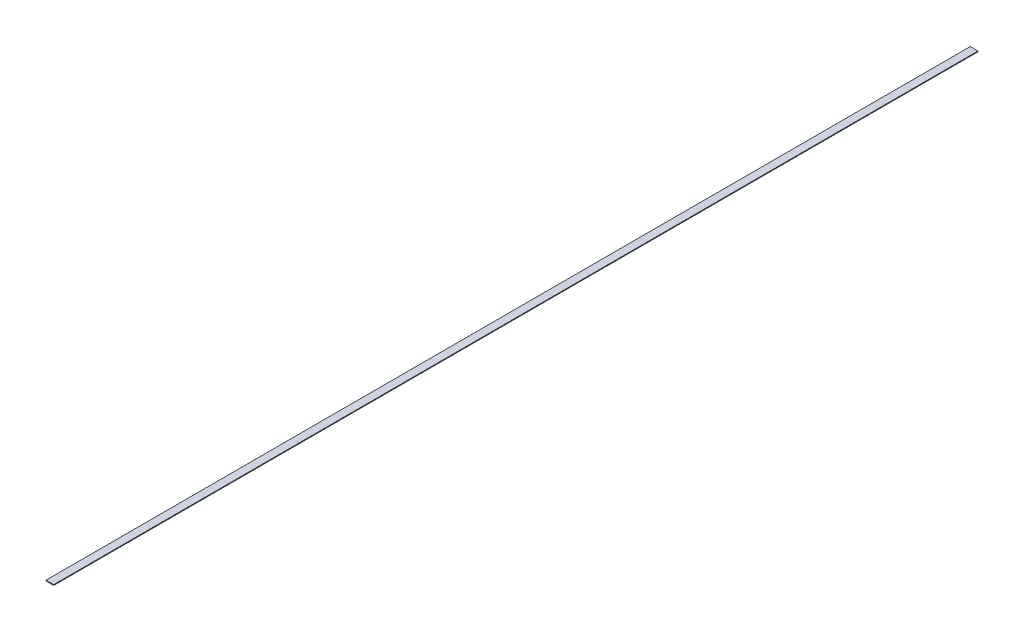
from build123d import *

# Parameters (mm, degrees)
BOSS_EXTRUDE1_DEPTH      = 1524
BOSS_EXTRUDE1_DEPTH_BACK = 1524
SKETCH3_W                = 25.4
SKETCH3_H                = 2.38125


with BuildPart() as part:
    # Sketch3 → Boss-Extrude1 (new, two sides: drawn at the far end of the back side and taken through both)
    with BuildSketch(Plane.XY.offset(-BOSS_EXTRUDE1_DEPTH_BACK)):
        Rectangle(SKETCH3_W, SKETCH3_H)
    extrude(amount=BOSS_EXTRUDE1_DEPTH + BOSS_EXTRUDE1_DEPTH_BACK)


solid = part.part
